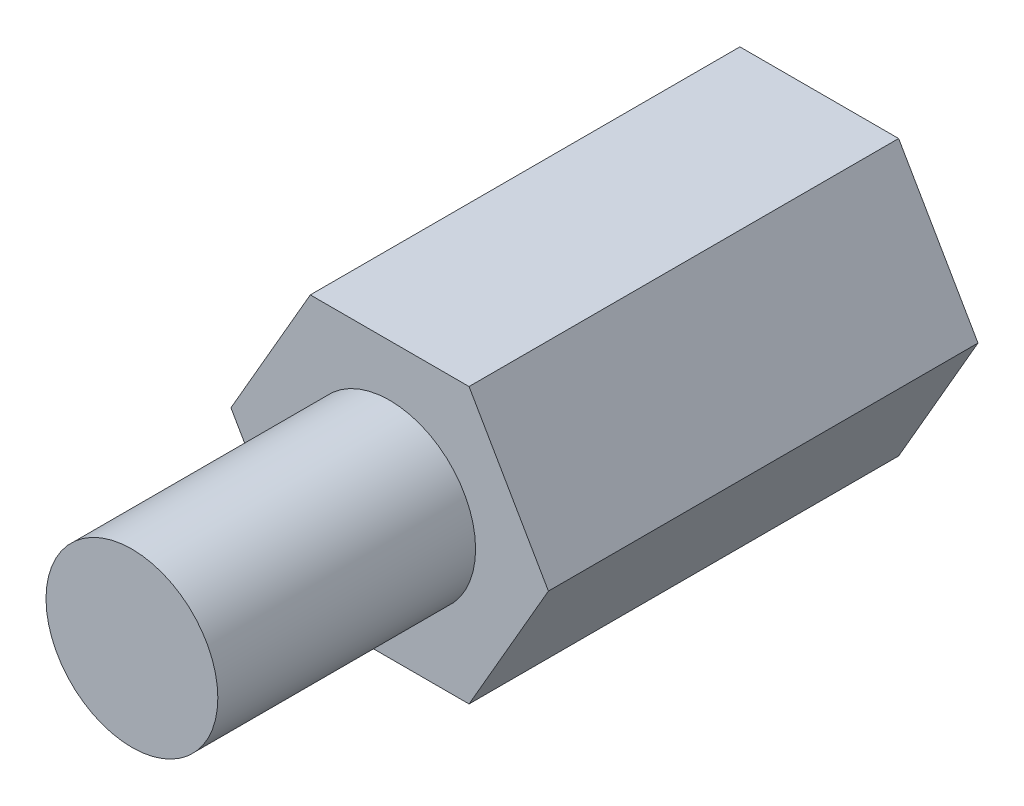
from build123d import *

# Parameters (mm, degrees)
EXTRUDE_1_DEPTH        = 5
SKETCH_2_R             = 1
EXTRUDE_2_DEPTH        = 3
HOLE_WIZARD_M2_1_D     = 1.6
HOLE_WIZARD_M2_1_DEPTH = 6
HOLE_WIZARD_M2_1_TIP   = 0.480688495


with BuildPart() as part:
    # 草图1 → 拉伸1 (new body)
    with BuildSketch(Plane.XY):
        Polygon((0.923760431, -1.6), (1.847520861, 0), (0.923760431, 1.6), (-0.923760431, 1.6), (-1.847520861, 0), (-0.923760431, -1.6), align=None)
    extrude(amount=EXTRUDE_1_DEPTH)

    # 草图2 → 拉伸2 (add)
    with BuildSketch(Plane.XY.offset(5)):
        with Locations(Location((0, 0, 0), (0, 0, 180))):
            Circle(SKETCH_2_R)
    extrude(amount=EXTRUDE_2_DEPTH)

    # M2 螺纹孔1
    with Locations(Plane(origin=(0, 0, 0), x_dir=(-1, 0, 0), z_dir=(0, 0, -1))):
        with Locations((0, 0)):
            Hole(HOLE_WIZARD_M2_1_D / 2, depth=HOLE_WIZARD_M2_1_DEPTH)
            with Locations((0, 0, -(HOLE_WIZARD_M2_1_DEPTH + HOLE_WIZARD_M2_1_TIP / 2))):  # 118° drill point
                Cone(0, HOLE_WIZARD_M2_1_D / 2, HOLE_WIZARD_M2_1_TIP, mode=Mode.SUBTRACT)


solid = part.part
